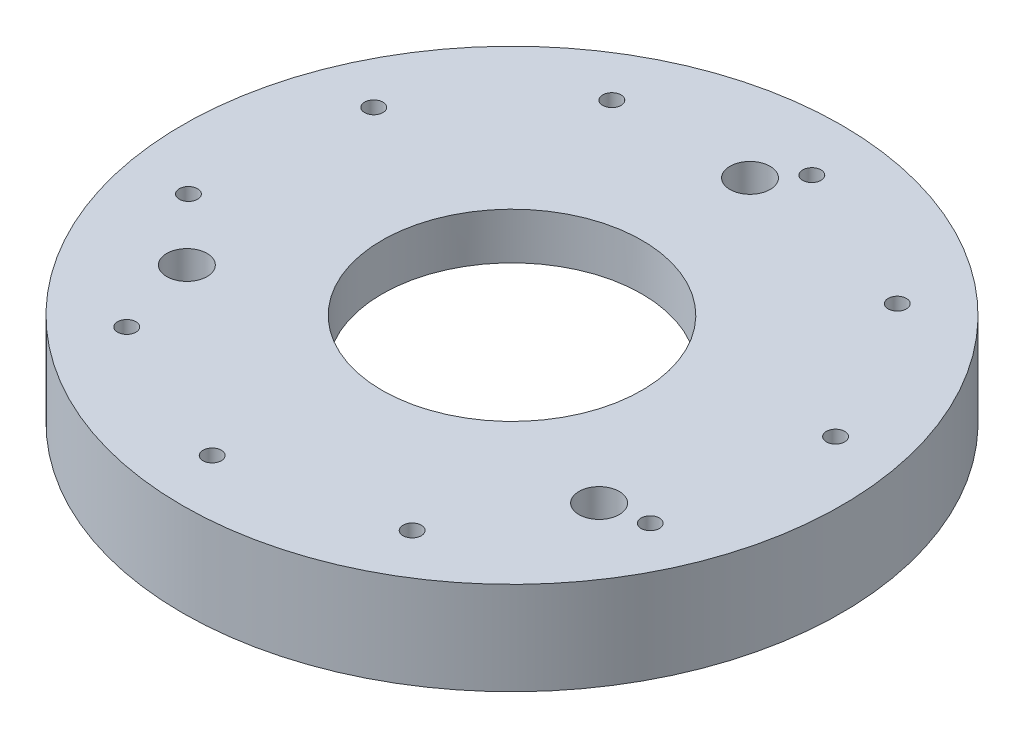
from build123d import *

# Parameters (mm, degrees)
SKETCH1_R           = 45
SKETCH1_R_2         = 2.75
SKETCH1_R_3         = 1.25
BOSS_EXTRUDE1_DEPTH = 12.7
SKETCH2_R           = 17.75
CUT_EXTRUDE1_DEPTH  = 6.35
SKETCH3_R           = 6
CUT_EXTRUDE2_DEPTH  = 64.95562915
SKETCH4_R           = 28.5
CUT_EXTRUDE3_DEPTH  = 6.35
SKETCH6_R           = 4.25
CUT_EXTRUDE4_DEPTH  = 6.35


with BuildPart() as part:
    # Sketch1 → Boss-Extrude1 (new body)
    with BuildSketch(Plane(origin=(0, 0, 0), x_dir=(1, 0, 0), z_dir=(0, 1, 0))):
        with Locations(Location((0, 0, 0), (0, 0, 270))):
            Circle(SKETCH1_R)
        with Locations(Location((0, 32.5, 0), (0, 0, 270))):
            Circle(SKETCH1_R_2, mode=Mode.SUBTRACT)
        with Locations(Location((28.145825623, -16.25, 0), (0, 0, 270))):
            Circle(SKETCH1_R_2, mode=Mode.SUBTRACT)
        with Locations(Location((-28.145825623, -16.25, 0), (0, 0, 270))):
            Circle(SKETCH1_R_2, mode=Mode.SUBTRACT)
        with Locations(Location((-36.435998127, -7.744710483, 0), (0, 0, 270))):
            Circle(SKETCH1_R_3, mode=Mode.SUBTRACT)
        with Locations(Location((-34.029568297, 15.150939955, 0), (0, 0, 270))):
            Circle(SKETCH1_R_3, mode=Mode.SUBTRACT)
        with Locations(Location((-18.625, 32.259446291, 0), (0, 0, 270))):
            Circle(SKETCH1_R_3, mode=Mode.SUBTRACT)
        with Locations(Location((3.893685257, 37.045940602, 0), (0, 0, 270))):
            Circle(SKETCH1_R_3, mode=Mode.SUBTRACT)
        with Locations(Location((24.925115087, 27.682144749, 0), (0, 0, 270))):
            Circle(SKETCH1_R_3, mode=Mode.SUBTRACT)
        with Locations(Location((36.435998127, 7.744710483, 0), (0, 0, 270))):
            Circle(SKETCH1_R_3, mode=Mode.SUBTRACT)
        with Locations(Location((34.029568297, -15.150939955, 0), (0, 0, 270))):
            Circle(SKETCH1_R_3, mode=Mode.SUBTRACT)
        with Locations(Location((18.625, -32.259446291, 0), (0, 0, 270))):
            Circle(SKETCH1_R_3, mode=Mode.SUBTRACT)
        with Locations(Location((-3.893685257, -37.045940602, 0), (0, 0, 270))):
            Circle(SKETCH1_R_3, mode=Mode.SUBTRACT)
        with Locations(Location((-24.925115087, -27.682144749, 0), (0, 0, 270))):
            Circle(SKETCH1_R_3, mode=Mode.SUBTRACT)
    extrude(amount=BOSS_EXTRUDE1_DEPTH)

    # Sketch2 → Cut-Extrude1 (cut)
    with BuildSketch(Plane(origin=(0, 12.7, 0), x_dir=(1, 0, 0), z_dir=(0, 1, 0))):
        with Locations(Location((0, 0, 0), (0, 0, 270))):
            Circle(SKETCH2_R)
    extrude(amount=-CUT_EXTRUDE1_DEPTH, mode=Mode.SUBTRACT)

    # Sketch3 → Cut-Extrude2 (cut, through all)
    with BuildSketch(Plane(origin=(0, 6.35, 0), x_dir=(1, 0, 0), z_dir=(0, 1, 0))):
        with Locations(Location((0, 0, 0), (0, 0, 270))):
            Circle(SKETCH3_R)
    extrude(amount=-CUT_EXTRUDE2_DEPTH, mode=Mode.SUBTRACT)

    # Sketch4 → Cut-Extrude3 (cut)
    with BuildSketch(Plane.XZ):
        with Locations(Location((0, 0, 0), (0, 0, 270))):
            Circle(SKETCH4_R)
    extrude(amount=-CUT_EXTRUDE3_DEPTH, mode=Mode.SUBTRACT)

    # Sketch6 → Cut-Extrude4 (cut)
    with BuildSketch(Plane.XZ):
        with Locations((28.145825623, 16.25)):
            Circle(SKETCH6_R)
        with Locations((0, -32.5)):
            Circle(SKETCH6_R)
        with Locations((-28.145825623, 16.25)):
            Circle(SKETCH6_R)
    extrude(amount=-CUT_EXTRUDE4_DEPTH, mode=Mode.SUBTRACT)


solid = part.part
